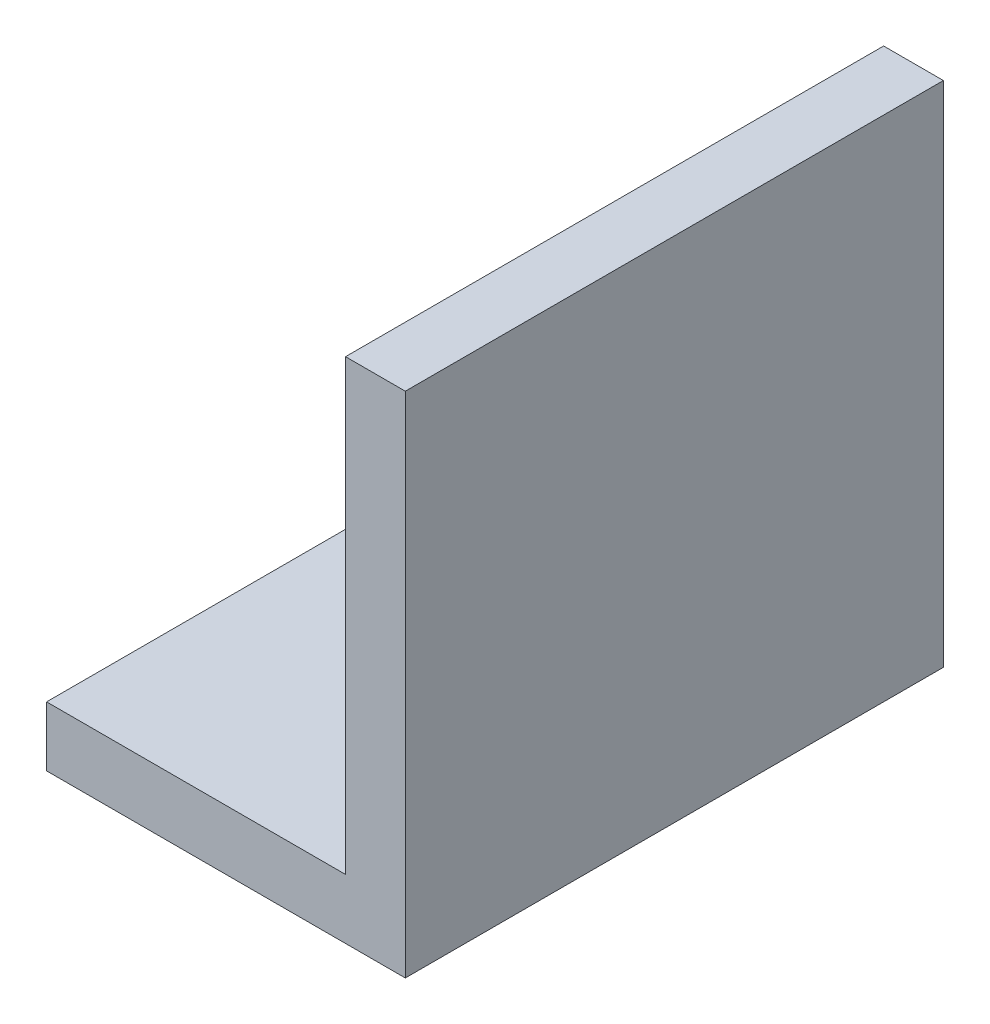
from build123d import *

# Parameters (mm, degrees)
EXTRUDE_1_DEPTH = 18


with BuildPart() as part:
    # Эскиз1 → Вытянуть-Тонкостенный1 (new body)
    with BuildSketch(Plane.XY):
        Polygon((0, 15), (0, 0), (-10, 0), (-10, -2), (2, -2), (2, 15), align=None)
    extrude(amount=EXTRUDE_1_DEPTH)


solid = part.part
